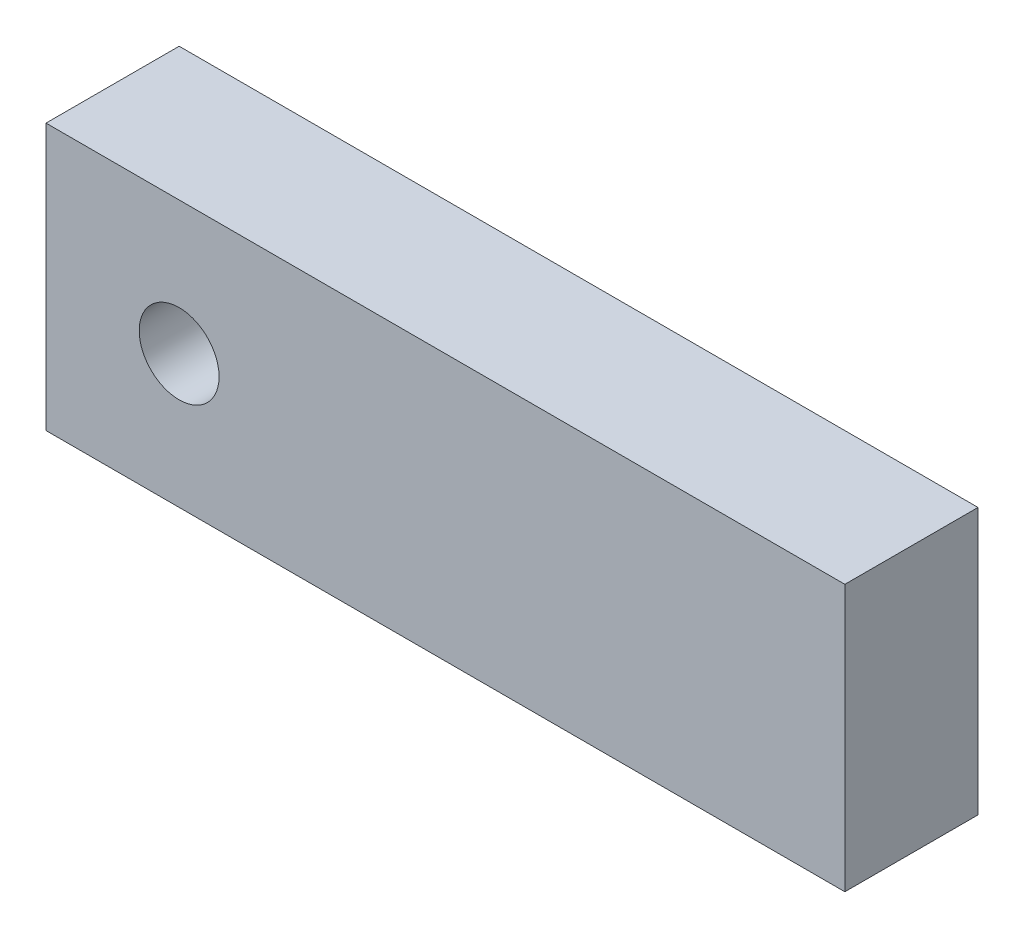
from build123d import *

# Parameters (mm, degrees)
SKETCH1_W           = 30
SKETCH1_H           = 10
BOSS_EXTRUDE1_DEPTH = 5
SKETCH2_R           = 1.5
CUT_EXTRUDE1_DEPTH  = 5


with BuildPart() as part:
    # Sketch1 → Boss-Extrude1 (new body)
    with BuildSketch(Plane.XY):
        Rectangle(SKETCH1_W, SKETCH1_H)
    extrude(amount=BOSS_EXTRUDE1_DEPTH)

    # Sketch2 → Cut-Extrude1 (cut)
    with BuildSketch(Plane.XY.offset(5)):
        with Locations((-10, 0)):
            Circle(SKETCH2_R)
    extrude(amount=-CUT_EXTRUDE1_DEPTH, mode=Mode.SUBTRACT)


solid = part.part
